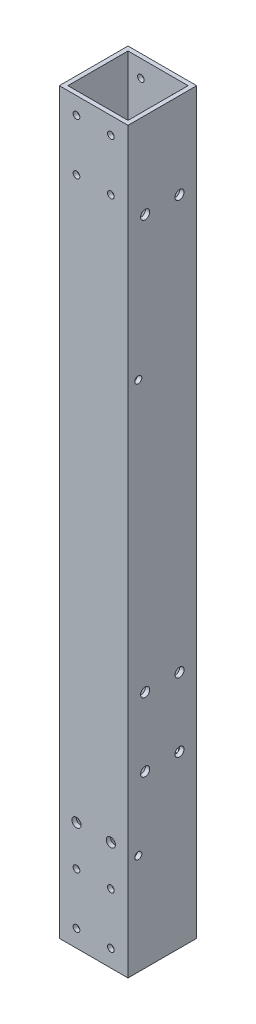
from build123d import *

# Parameters (mm, degrees)
SKETCH1_W                   = 50.8
SKETCH1_H                   = 50.8
SKETCH1_W_2                 = 44.45
SKETCH1_H_2                 = 44.45
BOSS_EXTRUDE1_DEPTH         = 546.1
CUT_EXTRUDE1_REACH          = 552.805
SKETCH2_R                   = 2.4638
CUT_EXTRUDE2_REACH          = 552.805
SKETCH3_R                   = 2.4638
F_1_4_0_25_DIAMETER_HOLE1_D = 6.746875
CUT_EXTRUDE3_REACH          = 552.805
SKETCH10_R                  = 2.579751
SKETCH10_R_2                = 2.61565382
SKETCH12_R                  = 3.3734375
CUT_EXTRUDE4_DEPTH          = 551.805310432
CUT_EXTRUDE5_REACH          = 552.805
SKETCH13_R                  = 2.5796875
SKETCH14_R                  = 3.3734375
CUT_EXTRUDE6_DEPTH          = 551.805310432
CUT_EXTRUDE7_REACH          = 552.805
SKETCH15_R                  = 6.35


with BuildPart() as part:
    # Sketch1 → Boss-Extrude1 (new body)
    with BuildSketch(Plane(origin=(0, 0, 0), x_dir=(1, 0, 0), z_dir=(0, 1, 0))):
        with Locations((25.4, 25.4)):
            Rectangle(SKETCH1_W, SKETCH1_H)
        with Locations((25.4, 25.4)):
            Rectangle(SKETCH1_W_2, SKETCH1_H_2, mode=Mode.SUBTRACT)
    extrude(amount=BOSS_EXTRUDE1_DEPTH)

    # Sketch2 → Cut-Extrude1 (cut, up to next)
    with BuildSketch(Plane.XY, mode=Mode.PRIVATE) as cut_extrude1_sk1:
        with Locations((38.1, 12.7)):
            Circle(SKETCH2_R)
    cut_extrude1_tool1 = extrude(cut_extrude1_sk1.sketch, amount=-CUT_EXTRUDE1_REACH, mode=Mode.PRIVATE) & part.part
    # Sketch2 → Cut-Extrude1 (cut, up to next)
    with BuildSketch(Plane.XY, mode=Mode.PRIVATE) as cut_extrude1_sk2:
        with Locations((12.7, 12.7)):
            Circle(SKETCH2_R)
    cut_extrude1_tool2 = extrude(cut_extrude1_sk2.sketch, amount=-CUT_EXTRUDE1_REACH, mode=Mode.PRIVATE) & part.part
    # Sketch2 → Cut-Extrude1 (cut, up to next)
    with BuildSketch(Plane.XY, mode=Mode.PRIVATE) as cut_extrude1_sk3:
        with Locations((12.7, 50.8)):
            Circle(SKETCH2_R)
    cut_extrude1_tool3 = extrude(cut_extrude1_sk3.sketch, amount=-CUT_EXTRUDE1_REACH, mode=Mode.PRIVATE) & part.part
    # Sketch2 → Cut-Extrude1 (cut, up to next)
    with BuildSketch(Plane.XY, mode=Mode.PRIVATE) as cut_extrude1_sk4:
        with Locations((38.1, 50.8)):
            Circle(SKETCH2_R)
    cut_extrude1_tool4 = extrude(cut_extrude1_sk4.sketch, amount=-CUT_EXTRUDE1_REACH, mode=Mode.PRIVATE) & part.part
    # Sketch2 → Cut-Extrude1 (cut, up to next)
    with BuildSketch(Plane.XY, mode=Mode.PRIVATE) as cut_extrude1_sk5:
        with Locations((38.1, 495.3)):
            Circle(SKETCH2_R)
    cut_extrude1_tool5 = extrude(cut_extrude1_sk5.sketch, amount=-CUT_EXTRUDE1_REACH, mode=Mode.PRIVATE) & part.part
    # Sketch2 → Cut-Extrude1 (cut, up to next)
    with BuildSketch(Plane.XY, mode=Mode.PRIVATE) as cut_extrude1_sk6:
        with Locations((12.7, 495.3)):
            Circle(SKETCH2_R)
    cut_extrude1_tool6 = extrude(cut_extrude1_sk6.sketch, amount=-CUT_EXTRUDE1_REACH, mode=Mode.PRIVATE) & part.part
    # Sketch2 → Cut-Extrude1 (cut, up to next)
    with BuildSketch(Plane.XY, mode=Mode.PRIVATE) as cut_extrude1_sk7:
        with Locations((12.7, 533.4)):
            Circle(SKETCH2_R)
    cut_extrude1_tool7 = extrude(cut_extrude1_sk7.sketch, amount=-CUT_EXTRUDE1_REACH, mode=Mode.PRIVATE) & part.part
    # Sketch2 → Cut-Extrude1 (cut, up to next)
    with BuildSketch(Plane.XY, mode=Mode.PRIVATE) as cut_extrude1_sk8:
        with Locations((38.1, 533.4)):
            Circle(SKETCH2_R)
    cut_extrude1_tool8 = extrude(cut_extrude1_sk8.sketch, amount=-CUT_EXTRUDE1_REACH, mode=Mode.PRIVATE) & part.part
    add(cut_extrude1_tool1.solids().sort_by_distance((38.1, 12.7, 0))[0], mode=Mode.SUBTRACT)
    add(cut_extrude1_tool2.solids().sort_by_distance((12.7, 12.7, 0))[0], mode=Mode.SUBTRACT)
    add(cut_extrude1_tool3.solids().sort_by_distance((12.7, 50.8, 0))[0], mode=Mode.SUBTRACT)
    add(cut_extrude1_tool4.solids().sort_by_distance((38.1, 50.8, 0))[0], mode=Mode.SUBTRACT)
    add(cut_extrude1_tool5.solids().sort_by_distance((38.1, 495.3, 0))[0], mode=Mode.SUBTRACT)
    add(cut_extrude1_tool6.solids().sort_by_distance((12.7, 495.3, 0))[0], mode=Mode.SUBTRACT)
    add(cut_extrude1_tool7.solids().sort_by_distance((12.7, 533.4, 0))[0], mode=Mode.SUBTRACT)
    add(cut_extrude1_tool8.solids().sort_by_distance((38.1, 533.4, 0))[0], mode=Mode.SUBTRACT)

    # Sketch3 → Cut-Extrude2 (cut, up to next)
    with BuildSketch(Plane(origin=(0, 0, -50.8), x_dir=(-1, 0, 0), z_dir=(0, 0, -1)), mode=Mode.PRIVATE) as cut_extrude2_sk1:
        with Locations(Location((-38.1, 533.4, 0), (0, 0, 180))):
            Circle(SKETCH3_R)
    cut_extrude2_tool1 = extrude(cut_extrude2_sk1.sketch, amount=-CUT_EXTRUDE2_REACH, mode=Mode.PRIVATE) & part.part
    # Sketch3 → Cut-Extrude2 (cut, up to next)
    with BuildSketch(Plane(origin=(0, 0, -50.8), x_dir=(-1, 0, 0), z_dir=(0, 0, -1)), mode=Mode.PRIVATE) as cut_extrude2_sk2:
        with Locations(Location((-12.7, 533.4, 0), (0, 0, 180))):
            Circle(SKETCH3_R)
    cut_extrude2_tool2 = extrude(cut_extrude2_sk2.sketch, amount=-CUT_EXTRUDE2_REACH, mode=Mode.PRIVATE) & part.part
    # Sketch3 → Cut-Extrude2 (cut, up to next)
    with BuildSketch(Plane(origin=(0, 0, -50.8), x_dir=(-1, 0, 0), z_dir=(0, 0, -1)), mode=Mode.PRIVATE) as cut_extrude2_sk3:
        with Locations((-38.1, 429.26)):
            Circle(SKETCH3_R)
    cut_extrude2_tool3 = extrude(cut_extrude2_sk3.sketch, amount=-CUT_EXTRUDE2_REACH, mode=Mode.PRIVATE) & part.part
    # Sketch3 → Cut-Extrude2 (cut, up to next)
    with BuildSketch(Plane(origin=(0, 0, -50.8), x_dir=(-1, 0, 0), z_dir=(0, 0, -1)), mode=Mode.PRIVATE) as cut_extrude2_sk4:
        with Locations((-12.7, 429.26)):
            Circle(SKETCH3_R)
    cut_extrude2_tool4 = extrude(cut_extrude2_sk4.sketch, amount=-CUT_EXTRUDE2_REACH, mode=Mode.PRIVATE) & part.part
    # Sketch3 → Cut-Extrude2 (cut, up to next)
    with BuildSketch(Plane(origin=(0, 0, -50.8), x_dir=(-1, 0, 0), z_dir=(0, 0, -1)), mode=Mode.PRIVATE) as cut_extrude2_sk5:
        with Locations((-38.1, 325.12)):
            Circle(SKETCH3_R)
    cut_extrude2_tool5 = extrude(cut_extrude2_sk5.sketch, amount=-CUT_EXTRUDE2_REACH, mode=Mode.PRIVATE) & part.part
    # Sketch3 → Cut-Extrude2 (cut, up to next)
    with BuildSketch(Plane(origin=(0, 0, -50.8), x_dir=(-1, 0, 0), z_dir=(0, 0, -1)), mode=Mode.PRIVATE) as cut_extrude2_sk6:
        with Locations((-12.7, 325.12)):
            Circle(SKETCH3_R)
    cut_extrude2_tool6 = extrude(cut_extrude2_sk6.sketch, amount=-CUT_EXTRUDE2_REACH, mode=Mode.PRIVATE) & part.part
    # Sketch3 → Cut-Extrude2 (cut, up to next)
    with BuildSketch(Plane(origin=(0, 0, -50.8), x_dir=(-1, 0, 0), z_dir=(0, 0, -1)), mode=Mode.PRIVATE) as cut_extrude2_sk7:
        with Locations((-38.1, 220.98)):
            Circle(SKETCH3_R)
    cut_extrude2_tool7 = extrude(cut_extrude2_sk7.sketch, amount=-CUT_EXTRUDE2_REACH, mode=Mode.PRIVATE) & part.part
    # Sketch3 → Cut-Extrude2 (cut, up to next)
    with BuildSketch(Plane(origin=(0, 0, -50.8), x_dir=(-1, 0, 0), z_dir=(0, 0, -1)), mode=Mode.PRIVATE) as cut_extrude2_sk8:
        with Locations((-12.7, 220.98)):
            Circle(SKETCH3_R)
    cut_extrude2_tool8 = extrude(cut_extrude2_sk8.sketch, amount=-CUT_EXTRUDE2_REACH, mode=Mode.PRIVATE) & part.part
    # Sketch3 → Cut-Extrude2 (cut, up to next)
    with BuildSketch(Plane(origin=(0, 0, -50.8), x_dir=(-1, 0, 0), z_dir=(0, 0, -1)), mode=Mode.PRIVATE) as cut_extrude2_sk9:
        with Locations((-38.1, 116.84)):
            Circle(SKETCH3_R)
    cut_extrude2_tool9 = extrude(cut_extrude2_sk9.sketch, amount=-CUT_EXTRUDE2_REACH, mode=Mode.PRIVATE) & part.part
    # Sketch3 → Cut-Extrude2 (cut, up to next)
    with BuildSketch(Plane(origin=(0, 0, -50.8), x_dir=(-1, 0, 0), z_dir=(0, 0, -1)), mode=Mode.PRIVATE) as cut_extrude2_sk10:
        with Locations((-12.7, 116.84)):
            Circle(SKETCH3_R)
    cut_extrude2_tool10 = extrude(cut_extrude2_sk10.sketch, amount=-CUT_EXTRUDE2_REACH, mode=Mode.PRIVATE) & part.part
    # Sketch3 → Cut-Extrude2 (cut, up to next)
    with BuildSketch(Plane(origin=(0, 0, -50.8), x_dir=(-1, 0, 0), z_dir=(0, 0, -1)), mode=Mode.PRIVATE) as cut_extrude2_sk11:
        with Locations(Location((-38.1, 12.7, 0), (0, 0, 180))):
            Circle(SKETCH3_R)
    cut_extrude2_tool11 = extrude(cut_extrude2_sk11.sketch, amount=-CUT_EXTRUDE2_REACH, mode=Mode.PRIVATE) & part.part
    # Sketch3 → Cut-Extrude2 (cut, up to next)
    with BuildSketch(Plane(origin=(0, 0, -50.8), x_dir=(-1, 0, 0), z_dir=(0, 0, -1)), mode=Mode.PRIVATE) as cut_extrude2_sk12:
        with Locations(Location((-12.7, 12.7, 0), (0, 0, 180))):
            Circle(SKETCH3_R)
    cut_extrude2_tool12 = extrude(cut_extrude2_sk12.sketch, amount=-CUT_EXTRUDE2_REACH, mode=Mode.PRIVATE) & part.part
    add(cut_extrude2_tool1.solids().sort_by_distance((38.1, 533.4, -50.8))[0], mode=Mode.SUBTRACT)
    add(cut_extrude2_tool2.solids().sort_by_distance((12.7, 533.4, -50.8))[0], mode=Mode.SUBTRACT)
    add(cut_extrude2_tool3.solids().sort_by_distance((38.1, 429.26, -50.8))[0], mode=Mode.SUBTRACT)
    add(cut_extrude2_tool4.solids().sort_by_distance((12.7, 429.26, -50.8))[0], mode=Mode.SUBTRACT)
    add(cut_extrude2_tool5.solids().sort_by_distance((38.1, 325.12, -50.8))[0], mode=Mode.SUBTRACT)
    add(cut_extrude2_tool6.solids().sort_by_distance((12.7, 325.12, -50.8))[0], mode=Mode.SUBTRACT)
    add(cut_extrude2_tool7.solids().sort_by_distance((38.1, 220.98, -50.8))[0], mode=Mode.SUBTRACT)
    add(cut_extrude2_tool8.solids().sort_by_distance((12.7, 220.98, -50.8))[0], mode=Mode.SUBTRACT)
    add(cut_extrude2_tool9.solids().sort_by_distance((38.1, 116.84, -50.8))[0], mode=Mode.SUBTRACT)
    add(cut_extrude2_tool10.solids().sort_by_distance((12.7, 116.84, -50.8))[0], mode=Mode.SUBTRACT)
    add(cut_extrude2_tool11.solids().sort_by_distance((38.1, 12.7, -50.8))[0], mode=Mode.SUBTRACT)
    add(cut_extrude2_tool12.solids().sort_by_distance((12.7, 12.7, -50.8))[0], mode=Mode.SUBTRACT)

    # 1/4 (0.25) Diameter Hole1 (through all)
    with Locations(Plane(origin=(50.8, 0, 0), x_dir=(0, 0, -1), z_dir=(1, 0, 0))):
        with Locations((12.7, 482.6), (38.1, 482.6)):
            Hole(F_1_4_0_25_DIAMETER_HOLE1_D / 2)

    # Sketch10 → Cut-Extrude3 (cut, up to next)
    with BuildSketch(Plane.ZY, mode=Mode.PRIVATE) as cut_extrude3_sk1:
        with Locations((-7.62, 356.241430513)):
            Circle(SKETCH10_R)
    cut_extrude3_tool1 = extrude(cut_extrude3_sk1.sketch, amount=-CUT_EXTRUDE3_REACH, mode=Mode.PRIVATE) & part.part
    # Sketch10 → Cut-Extrude3 (cut, up to next)
    with BuildSketch(Plane.ZY, mode=Mode.PRIVATE) as cut_extrude3_sk2:
        with Locations((-7.62, 221.657333333)):
            Circle(SKETCH10_R_2)
    cut_extrude3_tool2 = extrude(cut_extrude3_sk2.sketch, amount=-CUT_EXTRUDE3_REACH, mode=Mode.PRIVATE) & part.part
    add(cut_extrude3_tool1.solids().sort_by_distance((0, 356.241431, -7.62))[0], mode=Mode.SUBTRACT)
    add(cut_extrude3_tool2.solids().sort_by_distance((0, 221.657333, -7.62))[0], mode=Mode.SUBTRACT)

    # Sketch12 → Cut-Extrude4 (cut, through all)
    with BuildSketch(Plane.ZY):
        with Locations((-12.7, 176.702529248)):
            Circle(SKETCH12_R)
        with Locations((-12.7, 125.902529248)):
            Circle(SKETCH12_R)
        with Locations((-38.1, 125.902529248)):
            Circle(SKETCH12_R)
        with Locations((-38.1, 176.702529248)):
            Circle(SKETCH12_R)
    extrude(amount=-CUT_EXTRUDE4_DEPTH, mode=Mode.SUBTRACT)

    # Sketch13 → Cut-Extrude5 (cut, up to next)
    with BuildSketch(Plane(origin=(50.8, 0, 0), x_dir=(0, 0, -1), z_dir=(1, 0, 0)), mode=Mode.PRIVATE) as cut_extrude5_sk1:
        with Locations((7.62, 379.321029287)):
            Circle(SKETCH13_R)
    cut_extrude5_tool1 = extrude(cut_extrude5_sk1.sketch, amount=-CUT_EXTRUDE5_REACH, mode=Mode.PRIVATE) & part.part
    # Sketch13 → Cut-Extrude5 (cut, up to next)
    with BuildSketch(Plane(origin=(50.8, 0, 0), x_dir=(0, 0, -1), z_dir=(1, 0, 0)), mode=Mode.PRIVATE) as cut_extrude5_sk2:
        with Locations((7.62, 74.521029287)):
            Circle(SKETCH13_R)
    cut_extrude5_tool2 = extrude(cut_extrude5_sk2.sketch, amount=-CUT_EXTRUDE5_REACH, mode=Mode.PRIVATE) & part.part
    add(cut_extrude5_tool1.solids().sort_by_distance((50.8, 379.321029, -7.62))[0], mode=Mode.SUBTRACT)
    add(cut_extrude5_tool2.solids().sort_by_distance((50.8, 74.521029, -7.62))[0], mode=Mode.SUBTRACT)

    # Sketch14 → Cut-Extrude6 (cut, through all)
    with BuildSketch(Plane.XY):
        with Locations((12.7, 80.518)):
            Circle(SKETCH14_R)
        with Locations((38.1, 80.518)):
            Circle(SKETCH14_R)
    extrude(amount=-CUT_EXTRUDE6_DEPTH, mode=Mode.SUBTRACT)

    # Sketch15 → Cut-Extrude7 (cut, up to next)
    with BuildSketch(Plane(origin=(0, 0, -50.8), x_dir=(-1, 0, 0), z_dir=(0, 0, -1)), mode=Mode.PRIVATE) as cut_extrude7_sk1:
        with Locations((-38.1, 80.518)):
            Circle(SKETCH15_R)
    cut_extrude7_tool1 = extrude(cut_extrude7_sk1.sketch, amount=-CUT_EXTRUDE7_REACH, mode=Mode.PRIVATE) & part.part
    # Sketch15 → Cut-Extrude7 (cut, up to next)
    with BuildSketch(Plane(origin=(0, 0, -50.8), x_dir=(-1, 0, 0), z_dir=(0, 0, -1)), mode=Mode.PRIVATE) as cut_extrude7_sk2:
        with Locations((-12.7, 80.518)):
            Circle(SKETCH15_R)
    cut_extrude7_tool2 = extrude(cut_extrude7_sk2.sketch, amount=-CUT_EXTRUDE7_REACH, mode=Mode.PRIVATE) & part.part
    add(cut_extrude7_tool1.solids().sort_by_distance((38.1, 80.518, -50.8))[0], mode=Mode.SUBTRACT)
    add(cut_extrude7_tool2.solids().sort_by_distance((12.7, 80.518, -50.8))[0], mode=Mode.SUBTRACT)


solid = part.part
